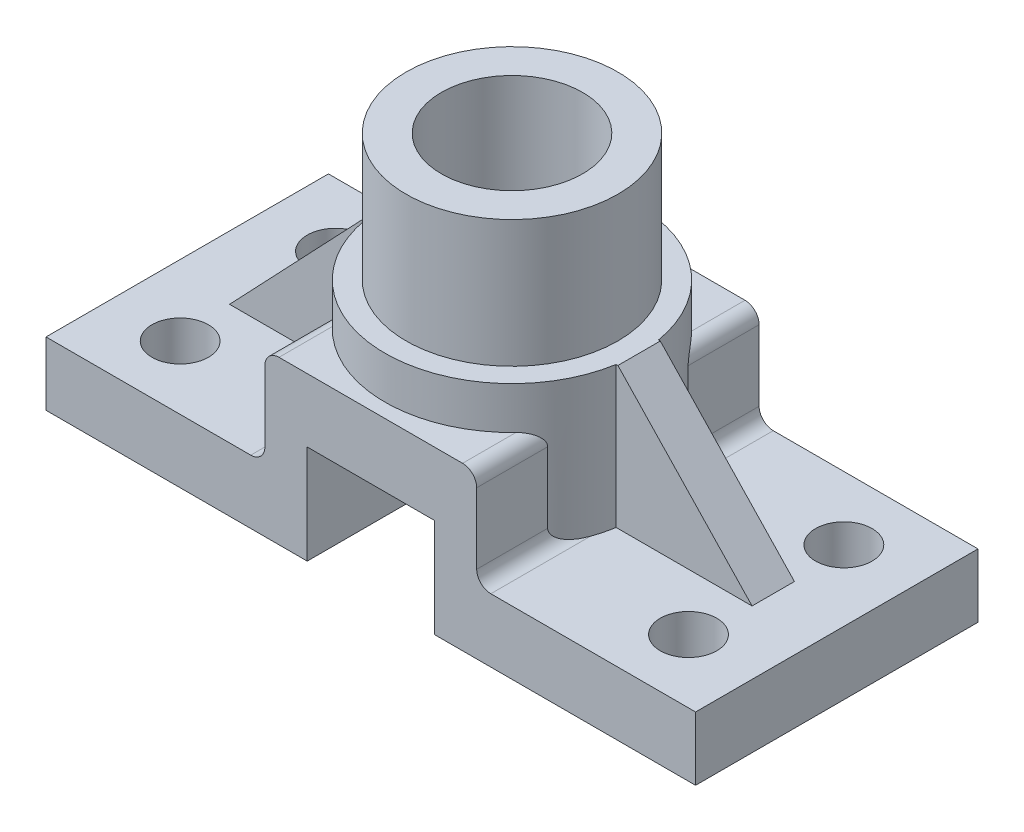
from build123d import *

# Parameters (mm, degrees)
BOSS_EXTRUDE1_DEPTH = 40
SKETCH2_R           = 4
CUT_EXTRUDE1_DEPTH  = 40
SKETCH3_R           = 4
CUT_EXTRUDE2_DEPTH  = 40
BOSS_EXTRUDE4_DEPTH = 18
BOSS_EXTRUDE5_REACH = 69.506
RIB7_REACH          = 62.042
SKETCH14_WALL_W     = 149.669532934
SKETCH14_WALL_H     = 6
CUT_EXTRUDE7_DEPTH  = 30
CUT_EXTRUDE8_START  = 30
SKETCH18_R          = 18
SKETCH18_R_2        = 15
CUT_EXTRUDE8_DEPTH  = 30
SKETCH16_R          = 18
SKETCH16_R_2        = 15
CUT_EXTRUDE5_DEPTH  = 18


with BuildPart() as part:
    # Sketch1 → Boss-Extrude1 (new body)
    with BuildSketch(Plane.XY):
        with BuildLine():
            Line((0, 0), (9, 0))
            Line((9, 0), (9, -14))
            Line((9, -14), (46, -14))
            Line((46, -14), (46, -5))
            Line((46, -5), (17, -5))
            ThreePointArc((17, -5), (15.585786438, -4.414213562), (15, -3))
            Line((15, -3), (15, 7))
            ThreePointArc((15, 7), (14.414213562, 8.414213562), (13, 9))
            Line((13, 9), (0, 9))
            Line((0, 9), (0, 0))
        make_face()
    extrude(amount=-BOSS_EXTRUDE1_DEPTH)

    # Sketch2 → Cut-Extrude1 (cut)
    with BuildSketch(Plane(origin=(0, -5, 0), x_dir=(1, 0, 0), z_dir=(0, 1, 0))):
        with Locations(Location((36, 9, 0), (0, 0, 180))):
            Circle(SKETCH2_R)
    extrude(amount=-CUT_EXTRUDE1_DEPTH, mode=Mode.SUBTRACT)

    # Sketch3 → Cut-Extrude2 (cut)
    with BuildSketch(Plane(origin=(0, -5, 0), x_dir=(1, 0, 0), z_dir=(0, 1, 0))):
        with Locations(Location((36, 31, 0), (0, 0, 180))):
            Circle(SKETCH3_R)
    extrude(amount=-CUT_EXTRUDE2_DEPTH, mode=Mode.SUBTRACT)

    # Sketch7 → Boss-Extrude5 (add, up to next)
    with BuildSketch(Plane(origin=(0, 15, 0), x_dir=(1, 0, 0), z_dir=(0, 1, 0)), mode=Mode.PRIVATE) as boss_extrude5_sk1:
        with BuildLine():
            Line((0, 2), (0, 20))
            Line((0, 20), (0, 38))
            ThreePointArc((0, 38), (18, 20), (0, 2))
        make_face()
    boss_extrude5_tool1 = extrude(boss_extrude5_sk1.sketch, amount=-BOSS_EXTRUDE5_REACH, mode=Mode.PRIVATE) - part.part


with BuildPart() as body_2:
    # Sketch4 → Boss-Extrude4 (new body)
    with BuildSketch(Plane(origin=(0, 15, 0), x_dir=(1, 0, 0), z_dir=(0, 1, 0))):
        with BuildLine():
            Line((0, 30), (0, 35))
            ThreePointArc((0, 35), (15, 20), (0, 5))
            Line((0, 5), (0, 10))
            ThreePointArc((0, 10), (10, 20), (0, 30))
        make_face()
    extrude(amount=BOSS_EXTRUDE4_DEPTH)


with BuildPart() as part_1:
    add(part.part)

    add(body_2.part)  # Boss-Extrude5 merges body 2
    add(boss_extrude5_tool1.solids().sort_by_distance((7.639437, 15, -20))[0])

    # Sketch14 wall → Rib7 (add, up to next)
    with BuildSketch(Plane(origin=(27.5, 5, -20), x_dir=(-0.688749461915, 0.724999433594, 0), z_dir=(0.724999433594, 0.688749461915, 0)), mode=Mode.PRIVATE) as rib7_sk1:
        Rectangle(SKETCH14_WALL_W, SKETCH14_WALL_H)
    rib7_tool1 = extrude(rib7_sk1.sketch, amount=-RIB7_REACH, mode=Mode.PRIVATE) - part_1.part
    add(rib7_tool1.solids().sort_by_distance((27.5, 5, -20))[0])

    # Sketch17 → Cut-Extrude7 (cut)
    with BuildSketch(Plane(origin=(46, 0, 0), x_dir=(0, 0, -1), z_dir=(1, 0, 0))):
        Polygon((20, 15), (35.006710278, 15), (35.006710278, 24.792153867), (20, 24.792153867), (5.167377758, 24.792153867), (5.167377758, 15), align=None)
    extrude(amount=-CUT_EXTRUDE7_DEPTH, mode=Mode.SUBTRACT)

    # Sketch18 → Cut-Extrude8 (cut)
    with BuildSketch(Plane(origin=(0, 15, 0), x_dir=(1, 0, 0), z_dir=(0, 1, 0)).offset(CUT_EXTRUDE8_START)):
        with Locations((0, 20)):
            Circle(SKETCH18_R)
        with Locations((0, 20)):
            Circle(SKETCH18_R_2, mode=Mode.SUBTRACT)
    extrude(amount=-CUT_EXTRUDE8_DEPTH, mode=Mode.SUBTRACT)

    # Mirror13: part across plane


with BuildPart() as part_2:
    add(part_1.part)
    add(part_1.part.mirror(Plane(origin=(0, 0, -40), x_dir=(0, 0, 1), z_dir=(-1, 0, 0))))

    # Sketch16 → Cut-Extrude5 (cut)
    with BuildSketch(Plane(origin=(0, 15, 0), x_dir=(1, 0, 0), z_dir=(0, 1, 0))):
        with Locations((0, 20)):
            Circle(SKETCH16_R)
        with Locations(Location((0, 20, 0), (0, 0, 180))):
            Circle(SKETCH16_R_2, mode=Mode.SUBTRACT)
    extrude(amount=CUT_EXTRUDE5_DEPTH, mode=Mode.SUBTRACT)


solid = part_2.part
